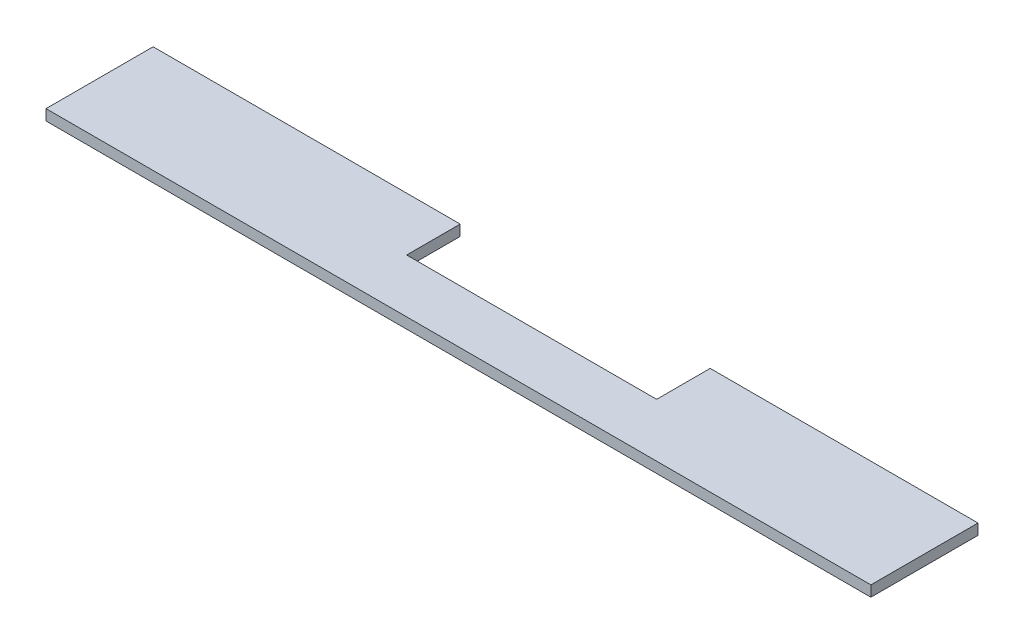
from build123d import *

# Parameters (mm, degrees)
SKETCH_1_W          = 231
SKETCH_1_H          = 30
EXTRUDE_1_DEPTH     = 3
SKETCH_2_W          = 70
SKETCH_2_H          = 15
CUT_EXTRUDE_1_DEPTH = 233.9592239


with BuildPart() as part:
    # 草圖1 → 填料-伸長1 (new body)
    with BuildSketch(Plane(origin=(0, 0, 0), x_dir=(1, 0, 0), z_dir=(0, 1, 0))):
        with Locations((115.5, 15)):
            Rectangle(SKETCH_1_W, SKETCH_1_H)
    extrude(amount=EXTRUDE_1_DEPTH)

    # 草圖2 → 除料-伸長1 (cut, through all)
    with BuildSketch(Plane(origin=(0, 3, 0), x_dir=(1, 0, 0), z_dir=(0, 1, 0))):
        with Locations((121, 22.5)):
            Rectangle(SKETCH_2_W, SKETCH_2_H)
    extrude(amount=-CUT_EXTRUDE_1_DEPTH, mode=Mode.SUBTRACT)


solid = part.part
